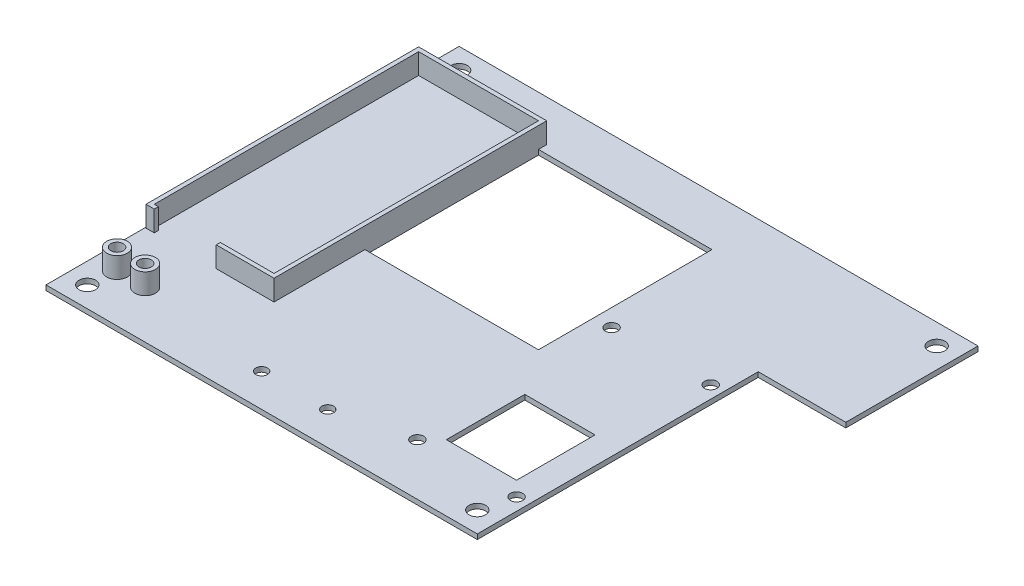
from build123d import *

# Parameters (mm, degrees)
SKETCH_1_R          = 2
SKETCH_1_R_2        = 1.5
SKETCH_1_R_3        = 1.4
SKETCH_1_W          = 42
SKETCH_1_H          = 42
SKETCH_1_W_2        = 17
SKETCH_1_H_2        = 19
EXTRUDE_1_DEPTH     = 1.2
SKETCH_2_R          = 2.5
SKETCH_2_R_2        = 1.5
SKETCH_2_W          = 31
SKETCH_2_H          = 66
SKETCH_2_W_2        = 29
SKETCH_2_H_2        = 64
EXTRUDE_2_DEPTH     = 5
SKETCH_3_W          = 15
SKETCH_3_H          = 3
CUT_EXTRUDE_1_DEPTH = 5


with BuildPart() as part:
    # 草图1 → 凸台-拉伸1 (new body)
    with BuildSketch(Plane(origin=(0, 0, 0), x_dir=(1, 0, 0), z_dir=(0, 1, 0))):
        Polygon((104.4, 68), (125.6, 68), (125.6, 100), (0, 100), (0, 0), (104.4, 0), align=None)
        with Locations(Location((5, 5, 0), (0, 0, 270))):
            Circle(SKETCH_1_R, mode=Mode.SUBTRACT)
        with Locations(Location((5, 95, 0), (0, 0, 90))):
            Circle(SKETCH_1_R, mode=Mode.SUBTRACT)
        with Locations(Location((120.6, 95, 0), (0, 0, 270))):
            Circle(SKETCH_1_R, mode=Mode.SUBTRACT)
        with Locations(Location((99.4, 5, 0), (0, 0, 90))):
            Circle(SKETCH_1_R, mode=Mode.SUBTRACT)
        with Locations(Location((101.4, 12.5, 0), (0, 0, 270))):
            Circle(SKETCH_1_R_2, mode=Mode.SUBTRACT)
        with Locations(Location((77.4, 12.5, 0), (0, 0, 90))):
            Circle(SKETCH_1_R_2, mode=Mode.SUBTRACT)
        with Locations(Location((101.4, 59.5, 0), (0, 0, 270))):
            Circle(SKETCH_1_R_2, mode=Mode.SUBTRACT)
        with Locations(Location((77.4, 59.5, 0), (0, 0, 90))):
            Circle(SKETCH_1_R_2, mode=Mode.SUBTRACT)
        with Locations(Location((60.2, 8, 0), (0, 0, 270))):
            Circle(SKETCH_1_R_3, mode=Mode.SUBTRACT)
        with Locations(Location((44.2, 8, 0), (0, 0, 90))):
            Circle(SKETCH_1_R_3, mode=Mode.SUBTRACT)
        with Locations((52.2, 67)):
            Rectangle(SKETCH_1_W, SKETCH_1_H, mode=Mode.SUBTRACT)
        with Locations((89.4, 25.5)):
            Rectangle(SKETCH_1_W_2, SKETCH_1_H_2, mode=Mode.SUBTRACT)
    extrude(amount=EXTRUDE_1_DEPTH)

    # 草图2 → 凸台-拉伸2 (add)
    # profile 1 of 3: a face of its own
    with BuildSketch(Plane(origin=(0, 1.2, 0), x_dir=(1, 0, 0), z_dir=(0, 1, 0))):
        with Locations(Location((12.5, 11.5, 0), (0, 0, 90))):
            Circle(SKETCH_2_R)
        with Locations(Location((12.5, 11.5, 0), (0, 0, 270))):
            Circle(SKETCH_2_R_2, mode=Mode.SUBTRACT)
    # profile 2 of 3: a face of its own
    with BuildSketch(Plane(origin=(0, 1.2, 0), x_dir=(1, 0, 0), z_dir=(0, 1, 0))):
        with Locations(Location((5.7, 11.5, 0), (0, 0, 90))):
            Circle(SKETCH_2_R)
        with Locations(Location((5.7, 11.5, 0), (0, 0, 270))):
            Circle(SKETCH_2_R_2, mode=Mode.SUBTRACT)
    # profile 3 of 3: a face of its own
    with BuildSketch(Plane(origin=(0, 1.2, 0), x_dir=(1, 0, 0), z_dir=(0, 1, 0))):
        with Locations((15.7, 57)):
            Rectangle(SKETCH_2_W, SKETCH_2_H)
        with Locations((15.7, 57)):
            Rectangle(SKETCH_2_W_2, SKETCH_2_H_2, mode=Mode.SUBTRACT)
    extrude(amount=EXTRUDE_2_DEPTH)

    # 草图3 → 切除-拉伸1 (cut)
    with BuildSketch(Plane(origin=(0, 6.2, 0), x_dir=(1, 0, 0), z_dir=(0, 1, 0))):
        with Locations((9.7, 25.5)):
            Rectangle(SKETCH_3_W, SKETCH_3_H)
    extrude(amount=-CUT_EXTRUDE_1_DEPTH, mode=Mode.SUBTRACT)


solid = part.part
